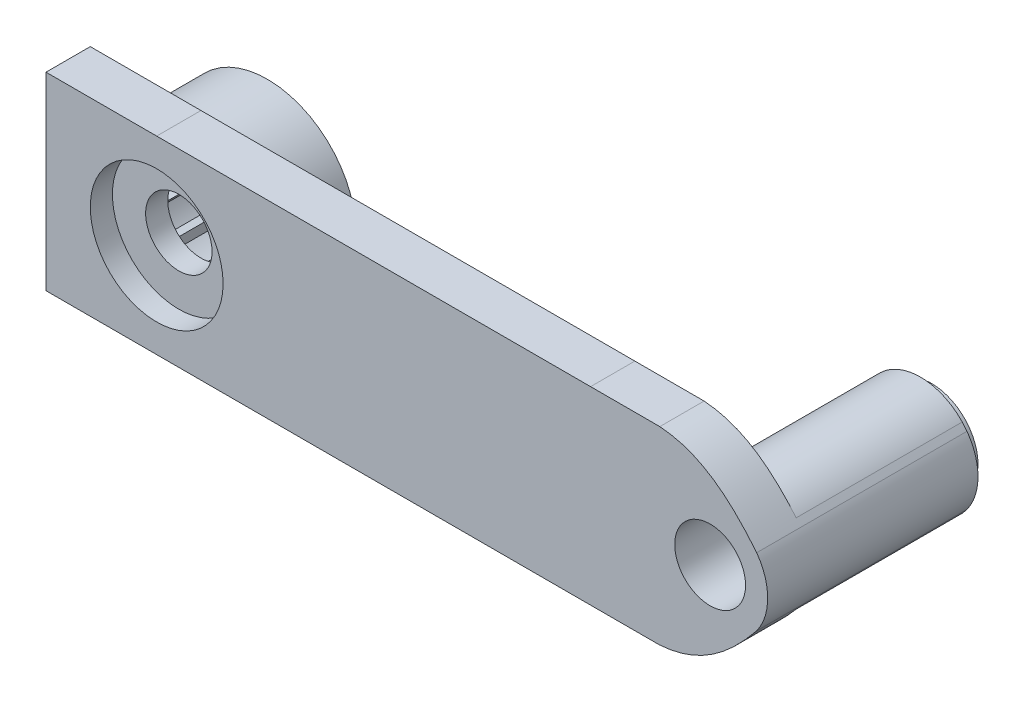
from build123d import *

# Parameters (mm, degrees)
ESBO_O1_R                 = 3
ESBO_O1_R_2               = 1.6
RESSALTO_EXTRUS_O1_DEPTH  = 2
ESBO_O1_4_R               = 3
ESBO_O1_4_R_2             = 1.5
RESSALTO_EXTRUS_O2_DEPTH  = 1
RESSALTO_EXTRUS_O3_START  = -7.5
ESBO_O1_5_R               = 1.6
RESSALTO_EXTRUS_O3_DEPTH  = 7.5
RESSALTO_EXTRUS_O18_START = -3
RESSALTO_EXTRUS_O18_DEPTH = 3
RESSALTO_EXTRUS_O21_START = -8
ESBO_O1_12_R              = 2.1
ESBO_O1_12_R_2            = 1.6
RESSALTO_EXTRUS_O21_DEPTH = 8
RESSALTO_EXTRUS_O22_DEPTH = 3
PADR_OCIRCULAR4_COUNT     = 13


with BuildPart() as part:
    # Esboço1 → Ressalto-extrusão1 (new body)
    with BuildSketch(Plane.XY):
        with BuildLine():
            add(Edge.make_bspline(
                [(3.201918926, -9.498277946), (5.089880376, -9.374786464), (6.418020478, -8.208302927), (7.603254861, -6.751780151)],
                knots=[0.106795249, 0.106795249, 0.106795249, 0.106795249, 1, 1, 1, 1], degree=3))
            ThreePointArc((7.603254861, -6.751780151), (8.1, -5.223277946), (7.603254861, -3.694775741))
            add(Edge.make_bspline(
                [(7.603254861, -3.694775741), (6.423329127, -2.244776711), (5.101774953, -1.082224575), (3.227253733, -0.95)],
                knots=[0.946595223, 0.946595223, 0.946595223, 0.946595223, 1.835799322, 1.835799322, 1.835799322, 1.835799322], degree=3))
            Line((3.227253733, -0.95), (0.099999924, -0.95))
            Line((0.099999924, -0.95), (-19.5, -0.948277946))
            Line((-19.5, -0.948277946), (-24.5, -0.948277946))
            Line((-24.5, -0.948277946), (-24.5, -9.498277946))
            Line((-24.5, -9.498277946), (3.201918926, -9.498277946))
        make_face()
        with Locations((-19.5, -5.223277946)):
            Circle(ESBO_O1_R, mode=Mode.SUBTRACT)
        with Locations((5.5, -5.223277946)):
            Circle(ESBO_O1_R_2, mode=Mode.SUBTRACT)
    extrude(amount=RESSALTO_EXTRUS_O1_DEPTH)

    # Esboço1<4> → Ressalto-extrusão2 (add)
    with BuildSketch(Plane.XY):
        with Locations((-19.5, -5.223277946)):
            Circle(ESBO_O1_4_R)
        with Locations((-19.5, -5.223277946)):
            Circle(ESBO_O1_4_R_2, mode=Mode.SUBTRACT)
    extrude(amount=RESSALTO_EXTRUS_O2_DEPTH)

    # Esboço1<5> → Ressalto-extrusão3 (add)
    with BuildSketch(Plane.XY.offset(RESSALTO_EXTRUS_O3_START)):
        with BuildLine():
            ThreePointArc((7.389037399, -3.436790413), (2.9, -5.223277946), (7.389037399, -7.009765479))
            add(Edge.make_bspline(
                [(7.389037399, -7.009765479), (7.461013495, -6.924914508), (7.532389611, -6.838865753), (7.603254861, -6.751780151)],
                knots=[0.946595223, 0.946595223, 0.946595223, 0.946595223, 1, 1, 1, 1], degree=3))
            ThreePointArc((7.603254861, -6.751780151), (8.1, -5.223277946), (7.603254861, -3.694775741))
            add(Edge.make_bspline(
                [(7.389037399, -3.436790413), (7.461013495, -3.521641384), (7.532389611, -3.607690139), (7.603254861, -3.694775741)],
                knots=[0.946595223, 0.946595223, 0.946595223, 0.946595223, 1, 1, 1, 1], degree=3))
        make_face()
        with Locations((5.5, -5.223277946)):
            Circle(ESBO_O1_5_R, mode=Mode.SUBTRACT)
    extrude(amount=RESSALTO_EXTRUS_O3_DEPTH)

    # Esboço1<10> → Ressalto-extrusão18 (add)
    with BuildSketch(Plane.XY.offset(RESSALTO_EXTRUS_O18_START)):
        with BuildLine():
            ThreePointArc((-19.5, -1.223277946), (-23.5, -5.223277946), (-19.5, -9.223277946))
            Line((-19.5, -9.223277946), (-19.5, -8.223277946))
            ThreePointArc((-19.5, -8.223277946), (-22.5, -5.223277946), (-19.5, -2.223277946))
            Line((-19.5, -2.223277946), (-19.5, -1.223277946))
        make_face()
        with BuildLine():
            Line((-19.5, -8.223277946), (-19.5, -9.223277946))
            ThreePointArc((-19.5, -9.223277946), (-16.671572875, -8.051705071), (-15.5, -5.223277946))
            ThreePointArc((-15.5, -5.223277946), (-16.671572875, -2.394850821), (-19.5, -1.223277946))
            Line((-19.5, -1.223277946), (-19.5, -2.223277946))
            ThreePointArc((-19.5, -2.223277946), (-17.378679656, -3.101957603), (-16.5, -5.223277946))
            ThreePointArc((-16.5, -5.223277946), (-17.378679656, -7.34459829), (-19.5, -8.223277946))
        make_face()
    extrude(amount=RESSALTO_EXTRUS_O18_DEPTH)

    # Esboço1<12> → Ressalto-extrusão21 (add)
    with BuildSketch(Plane.XY.offset(RESSALTO_EXTRUS_O21_START)):
        with Locations((5.5, -5.223277946)):
            Circle(ESBO_O1_12_R)
        with Locations((5.5, -5.223277946)):
            Circle(ESBO_O1_12_R_2, mode=Mode.SUBTRACT)
    extrude(amount=RESSALTO_EXTRUS_O21_DEPTH)

    # Esboço4 → Ressalto-extrusão22 (add)
    with BuildSketch(Plane(origin=(0, 0, -3), x_dir=(-1, 0, 0), z_dir=(0, 0, -1))):
        with BuildLine():
            Line((16.861766136, -3.795089556), (17.42229309, -3.832074862))
            Line((17.42229309, -3.832074862), (17.007212736, -3.554142944))
            ThreePointArc((17.007212736, -3.554142944), (16.931662352, -3.67290969), (16.861766136, -3.795089556))
        make_face()
        with BuildLine():
            Line((17.007212736, -3.554142944), (17.42229309, -3.832074862))
            Line((17.42229309, -3.832074862), (17.422825904, -3.832110019))
            Line((17.422825904, -3.832110019), (17.174502722, -3.328004244))
            ThreePointArc((17.174502722, -3.328004244), (17.088205821, -3.439111799), (17.007212736, -3.554142944))
        make_face()
    ressalto_extrus_o22 = extrude(amount=-RESSALTO_EXTRUS_O22_DEPTH)

    # PadrãoCircular4: Ressalto-extrusão22 ×13 about axis
    padr_ocircular4_axis = Axis((-19.5, -5.223277946, 0), (0, 0, 1))
    for i in range(1, PADR_OCIRCULAR4_COUNT):
        add(ressalto_extrus_o22.rotate(padr_ocircular4_axis, i * 360 / PADR_OCIRCULAR4_COUNT))


solid = part.part
